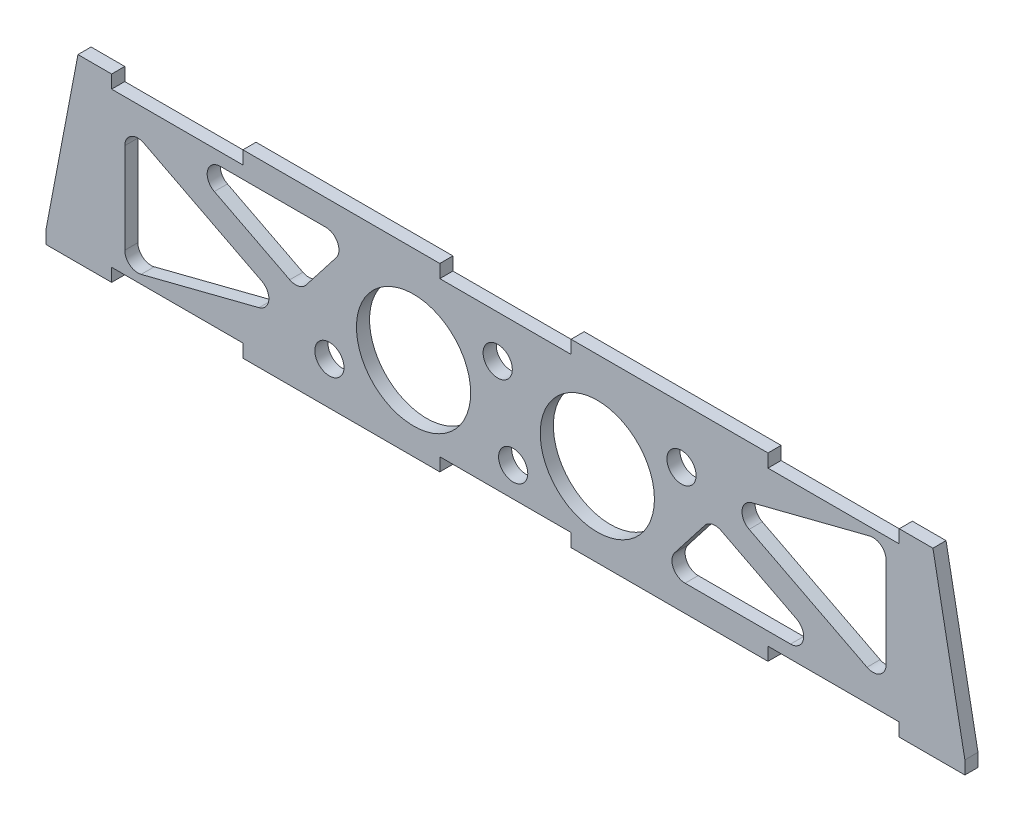
from build123d import *

# Parameters (mm, degrees)
SKETCH2_R           = 17.4
SKETCH2_R_2         = 4.45
BOSS_EXTRUDE1_DEPTH = 4


with BuildPart() as part:
    # Sketch2 → Boss-Extrude1 (new body)
    with BuildSketch(Plane.XY):
        Polygon((53.044712849, 33.544372616), (42.778880935, 33.544372616), (42.778880935, 29.544372616), (2.778880935, 29.544372616), (2.778880935, 33.544372616), (-57.221119065, 33.544372616), (-57.221119065, 29.544372616), (-97.221119065, 29.544372616), (-97.221119065, 33.544372616), (-157.221119065, 33.544372616), (-157.221119065, 29.544372616), (-197.221119065, 29.544372616), (-197.221119065, 33.544372616), (-207.486950979, 33.544372616), (-217.221119065, -17.455627384), (-217.221119065, -21.455627384), (-197.221119065, -21.455627384), (-197.221119065, -17.455627384), (-157.221119065, -17.455627384), (-157.221119065, -21.455627384), (-97.221119065, -21.455627384), (-97.221119065, -17.455627384), (-57.221119065, -17.455627384), (-57.221119065, -21.455627384), (2.778880935, -21.455627384), (2.778880935, -17.455627384), (42.778880935, -17.455627384), (42.778880935, -21.455627384), (62.778880935, -21.455627384), (62.778880935, -17.455627384), align=None)
        with Locations((-105.221119065, 4.044372616)):
            Circle(SKETCH2_R, mode=Mode.SUBTRACT)
        with Locations((-130.864831745, -8.505627384)):
            Circle(SKETCH2_R_2, mode=Mode.SUBTRACT)
        with Locations((-79.577406385, 16.594372616)):
            Circle(SKETCH2_R_2, mode=Mode.SUBTRACT)
        with Locations((-74.864831745, -8.505627384)):
            Circle(SKETCH2_R_2, mode=Mode.SUBTRACT)
        with Locations((-49.221119065, 4.044372616)):
            Circle(SKETCH2_R, mode=Mode.SUBTRACT)
        with Locations((-23.577406385, 16.594372616)):
            Circle(SKETCH2_R_2, mode=Mode.SUBTRACT)
        with BuildLine():
            Line((-16.476478057, 4.792165998), (-25.639690827, -7.001469778))
            ThreePointArc((-25.639690827, -7.001469778), (-26.073848783, -11.213946123), (-22.481034397, -13.455627384))
            Line((-22.481034397, -13.455627384), (9.665493618, -13.455627384))
            ThreePointArc((9.665493618, -13.455627384), (13.553631861, -10.39497876), (11.491657622, -5.896817888))
            Line((11.491657622, -5.896817888), (-11.491657622, 5.896817888))
            ThreePointArc((-11.491657622, 5.896817888), (-14.183239425, 6.243267926), (-16.476478057, 4.792165998))
        make_face(mode=Mode.SUBTRACT)
        with BuildLine():
            Line((-165.933895752, 18.177294134), (-142.950580507, 6.383658359))
            ThreePointArc((-142.950580507, 6.383658359), (-140.258998705, 6.03720832), (-137.965760073, 7.488310249))
            Line((-137.965760073, 7.488310249), (-128.802547302, 19.281946025))
            ThreePointArc((-128.802547302, 19.281946025), (-128.368389347, 23.49442237), (-131.961203733, 25.736103631))
            Line((-131.961203733, 25.736103631), (-164.107731748, 25.736103631))
            ThreePointArc((-164.107731748, 25.736103631), (-167.995869991, 22.675455007), (-165.933895752, 18.177294134))
        make_face(mode=Mode.SUBTRACT)
        with BuildLine():
            Line((38.778880935, -4.35874426), (38.778880935, 23.243985793))
            ThreePointArc((38.778880935, 23.243985793), (37.232462018, 26.403090076), (33.788911001, 27.119545047))
            Line((33.788911001, 27.119545047), (-2.125102454, 17.94569653))
            ThreePointArc((-2.125102454, 17.94569653), (-5.110068026, 14.517225335), (-2.961296525, 10.511327779))
            Line((-2.961296525, 10.511327779), (32.952716931, -7.917553756))
            ThreePointArc((32.952716931, -7.917553756), (36.863988125, -7.772294905), (38.778880935, -4.35874426))
        make_face(mode=Mode.SUBTRACT)
        with BuildLine():
            Line((-188.231149131, -14.839068801), (-152.317135675, -5.665220283))
            ThreePointArc((-152.317135675, -5.665220283), (-149.332170104, -2.236749089), (-151.480941605, 1.769148467))
            Line((-151.480941605, 1.769148467), (-187.394955061, 20.198030003))
            ThreePointArc((-187.394955061, 20.198030003), (-191.306226254, 20.052771152), (-193.221119065, 16.639220507))
            Line((-193.221119065, 16.639220507), (-193.221119065, -10.963509547))
            ThreePointArc((-193.221119065, -10.963509547), (-191.674700148, -14.122613829), (-188.231149131, -14.839068801))
        make_face(mode=Mode.SUBTRACT)
    extrude(amount=BOSS_EXTRUDE1_DEPTH)


solid = part.part
